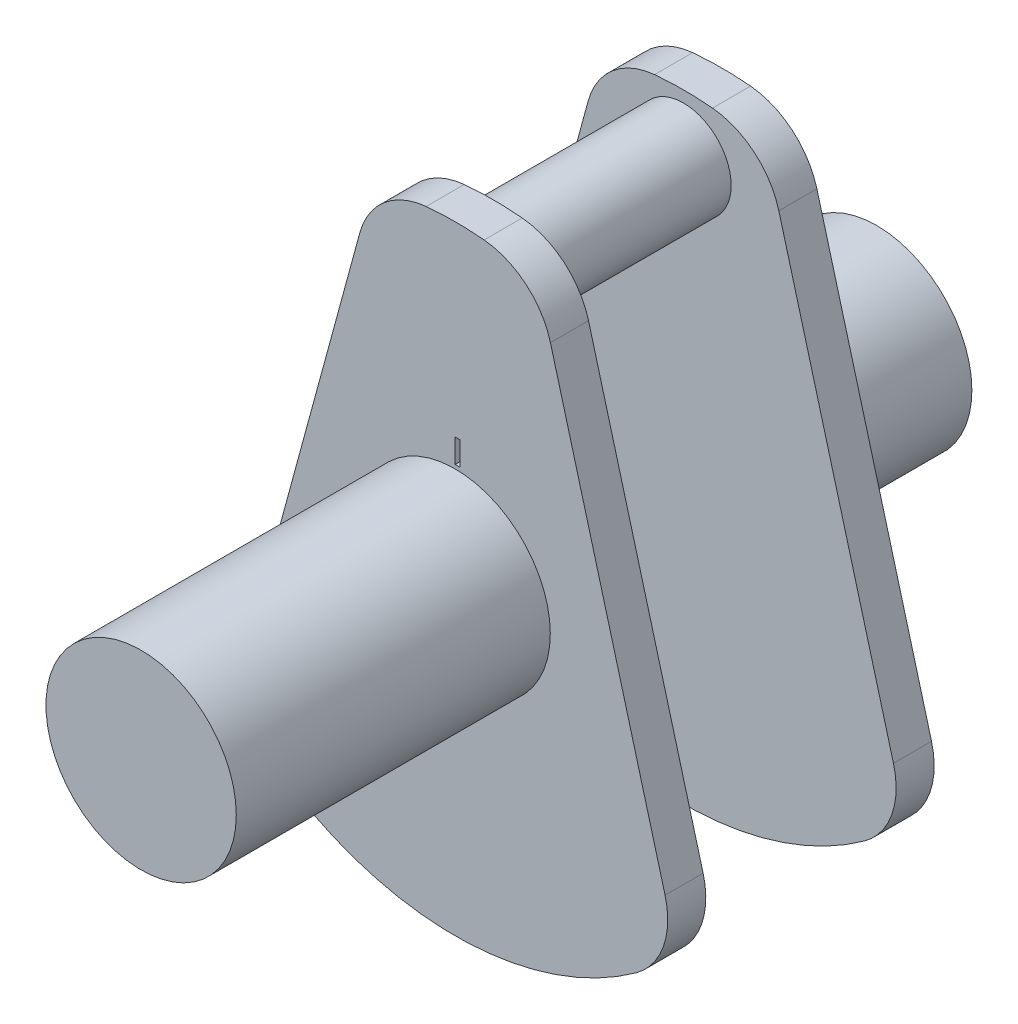
from build123d import *

# Parameters (mm, degrees)
BOSS_EXTRUDE1_DEPTH = 0.8
SKETCH3_R           = 1
BOSS_EXTRUDE2_DEPTH = 2
SKETCH4_R           = 2
BOSS_EXTRUDE3_DEPTH = 3.26
SKETCH8_R           = 2
BOSS_EXTRUDE4_DEPTH = 3.34
SKETCH9_W           = 0.1
SKETCH9_H           = 0.5
CUT_EXTRUDE1_DEPTH  = 0.1


with BuildPart() as part:
    # Sketch2 → Boss-Extrude1 (new body)
    with BuildSketch(Plane.XY):
        with BuildLine():
            Line((-2.002843202, 5.298630925), (-4.411867861, -3.552786589))
            ThreePointArc((-4.411867861, -3.552786589), (-4.376483825, -4.506396112), (-3.804522508, -5.270256966))
            ThreePointArc((-3.804522508, -5.270256966), (0, -6.5), (3.804522508, -5.270256966))
            ThreePointArc((3.804522508, -5.270256966), (4.376483825, -4.506396112), (4.411867861, -3.552786589))
            Line((4.411867861, -3.552786589), (2.002843202, 5.298630925))
            ThreePointArc((2.002843202, 5.298630925), (1.489063424, 6.102778606), (0.608877551, 6.471419329))
            ThreePointArc((0.608877551, 6.471419329), (0, 6.5), (-0.608877551, 6.471419329))
            ThreePointArc((-0.608877551, 6.471419329), (-1.489063424, 6.102778606), (-2.002843202, 5.298630925))
        make_face()
    extrude(amount=BOSS_EXTRUDE1_DEPTH)

    # Sketch3 → Boss-Extrude2 (add)
    with BuildSketch(Plane.XY.offset(0.8)):
        with Locations((0, 5.259)):
            Circle(SKETCH3_R)
    extrude(amount=BOSS_EXTRUDE2_DEPTH)

    # Sketch4 → Boss-Extrude3 (add)
    with BuildSketch(Plane(origin=(0, 0, 0), x_dir=(-1, 0, 0), z_dir=(0, 0, -1))):
        with Locations(Location((0, 0, 0), (0, 0, 180))):
            Circle(SKETCH4_R)
    extrude(amount=BOSS_EXTRUDE3_DEPTH)

    # Mirror1: part across plane


with BuildPart() as part_1:
    add(part.part)
    add(part.part.mirror(Plane(origin=(0, 5.259, 2.8), x_dir=(1, 0, 0), z_dir=(0, 0, 1))))

    # Sketch8 → Boss-Extrude4 (add)
    with BuildSketch(Plane.XY.offset(8.86)):
        Circle(SKETCH8_R)
    extrude(amount=BOSS_EXTRUDE4_DEPTH)

    # Sketch9 → Cut-Extrude1 (cut)
    with BuildSketch(Plane.XY.offset(5.6)):
        with Locations((0.05, 2.330034625)):
            Rectangle(SKETCH9_W, SKETCH9_H)
    extrude(amount=-CUT_EXTRUDE1_DEPTH, mode=Mode.SUBTRACT)


solid = part_1.part
